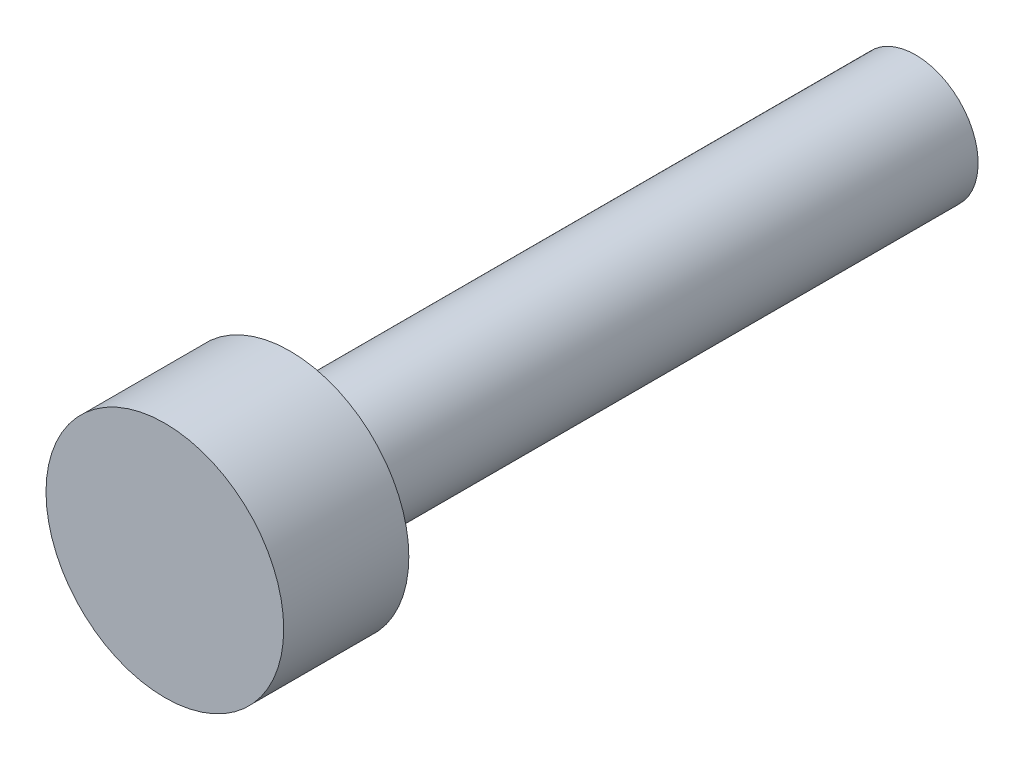
from build123d import *

# Parameters (mm, degrees)
SKETCH1_R           = 3.8
BOSS_EXTRUDE1_DEPTH = 4
SKETCH2_R           = 2
BOSS_EXTRUDE2_DEPTH = 20


with BuildPart() as part:
    # Sketch1 → Boss-Extrude1 (new body)
    with BuildSketch(Plane.XY):
        Circle(SKETCH1_R)
    extrude(amount=BOSS_EXTRUDE1_DEPTH)

    # Sketch2 → Boss-Extrude2 (add)
    with BuildSketch(Plane(origin=(0, 0, 0), x_dir=(-1, 0, 0), z_dir=(0, 0, -1))):
        Circle(SKETCH2_R)
    extrude(amount=BOSS_EXTRUDE2_DEPTH)


solid = part.part
